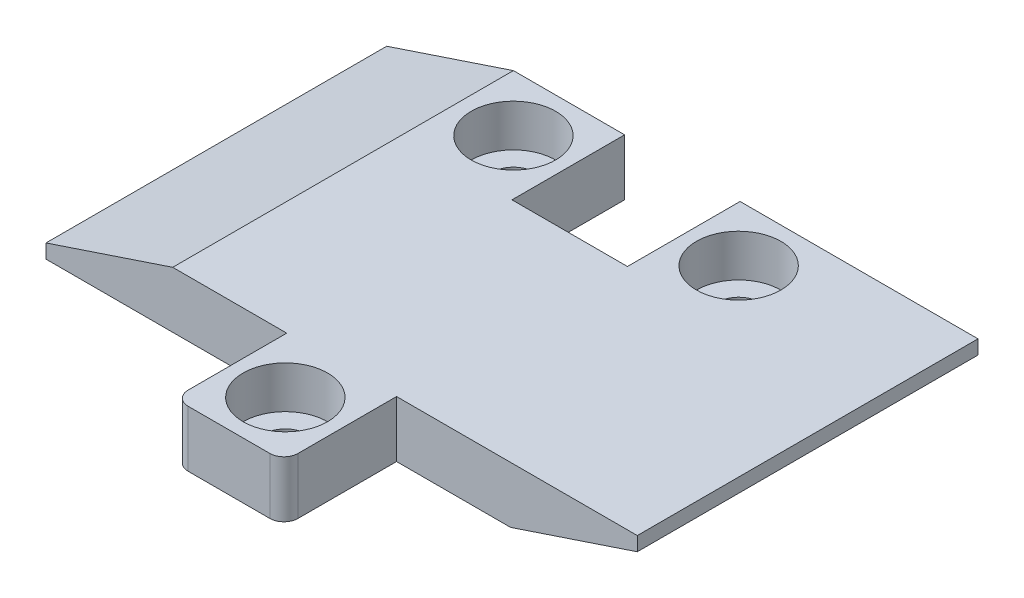
from build123d import *

# Parameters (mm, degrees)
EXTRUDE_1_DEPTH     = 4
SKETCH_2_R          = 1.5
CUT_EXTRUDE_2_DEPTH = 27.762100067
SKETCH_3_R          = 3
CUT_EXTRUDE_3_DEPTH = 3
CUT_EXTRUDE_4_DEPTH = 39.65022639
FILLET_1_R          = 1


with BuildPart() as part:
    # 草图1 → 凸台-拉伸1 (new body)
    with BuildSketch(Plane(origin=(0, 0, 0), x_dir=(1, 0, 0), z_dir=(0, 1, 0))):
        Polygon((-21, 16.1), (-4.1, 16.1), (-4.1, 8.1), (4.1, 8.1), (4.1, 16.1), (21, 16.1), (21, -8.1), (3.9, -8.1), (3.9, -16.1), (-3.9, -16.1), (-3.9, -8.1), (-21, -8.1), align=None)
    extrude(amount=EXTRUDE_1_DEPTH)

    # 草图2 → 切除-拉伸2 (cut, through all)
    with BuildSketch(Plane(origin=(0, 0, 0), x_dir=(1, 0, 0), z_dir=(0, 1, 0))):
        with Locations(Location((-8, 12.1, 0), (0, 0, 270))):
            Circle(SKETCH_2_R)
        with Locations(Location((8, 12.1, 0), (0, 0, 270))):
            Circle(SKETCH_2_R)
        with Locations(Location((0, -12.1, 0), (0, 0, 270))):
            Circle(SKETCH_2_R)
    extrude(amount=CUT_EXTRUDE_2_DEPTH, mode=Mode.SUBTRACT)

    # 草图3 → 切除-拉伸3 (cut)
    with BuildSketch(Plane(origin=(0, 4, 0), x_dir=(1, 0, 0), z_dir=(0, 1, 0))):
        with Locations(Location((-8, 12.1, 0), (0, 0, 270))):
            Circle(SKETCH_3_R)
        with Locations(Location((8, 12.1, 0), (0, 0, 270))):
            Circle(SKETCH_3_R)
        with Locations(Location((0, -12.1, 0), (0, 0, 270))):
            Circle(SKETCH_3_R)
    extrude(amount=-CUT_EXTRUDE_3_DEPTH, mode=Mode.SUBTRACT)

    # 草图4 → 切除-拉伸4 (cut, through all)
    with BuildSketch(Plane(origin=(0, 0, -16.1), x_dir=(-1, 0, 0), z_dir=(0, 0, -1))):
        Polygon((-21, 3), (-12, 0), (-21, 0), align=None)
        Polygon((12, 4), (21, 1), (21, 4), align=None)
    extrude(amount=-CUT_EXTRUDE_4_DEPTH, mode=Mode.SUBTRACT)

    # 圆角1
    fillet_1_edges = [part.edges().sort_by_distance(p)[0] for p in [
        (3.9, 2, 16.1),
        (-3.9, 2, 16.1),
    ]]
    fillet(fillet_1_edges, radius=FILLET_1_R)


solid = part.part
